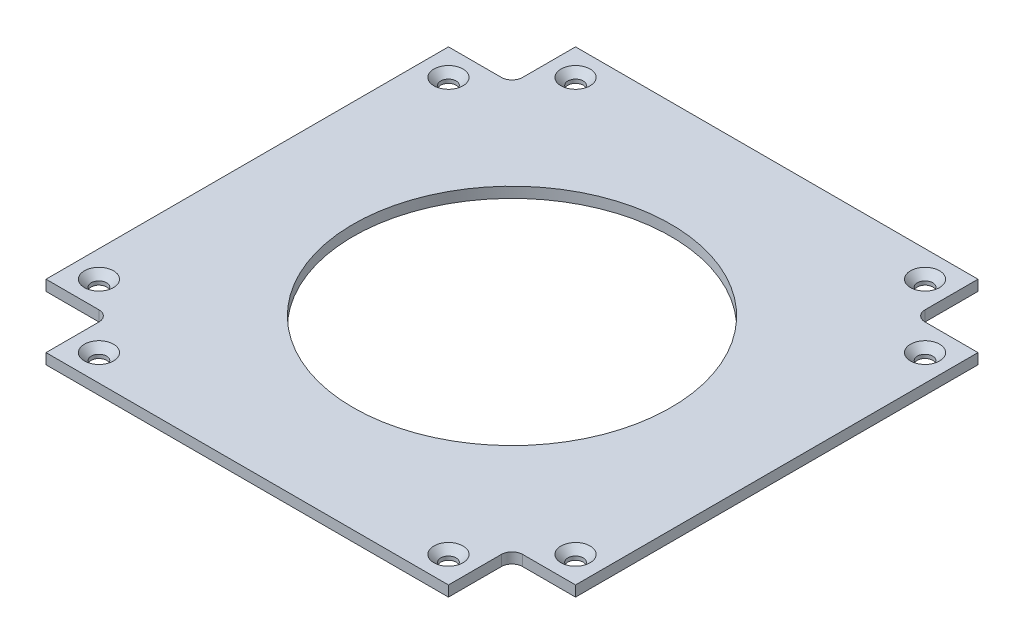
from build123d import *

# Parameters (mm, degrees)
SCHIZZO1_R                              = 30
ESTRUSIONE_ESTRUSIONE1_DEPTH            = 1
RACCORDO1_R                             = 2
FORO_SVASATO_PER_VITE_M2_5_1_AT_2_COUNT = 2
FORO_SVASATO_PER_VITE_M2_5_1_AT_2_PITCH = 16.970562748
FORO_SVASATO_PER_VITE_M2_5_1_AT_3_COUNT = 2
FORO_SVASATO_PER_VITE_M2_5_1_AT_3_PITCH = 78.917678628
FORO_SVASATO_PER_VITE_M2_5_1_AT_4_COUNT = 2
FORO_SVASATO_PER_VITE_M2_5_1_AT_4_PITCH = 90
FORO_SVASATO_PER_VITE_M2_5_1_AT_5_COUNT = 2
FORO_SVASATO_PER_VITE_M2_5_1_AT_5_PITCH = 111.606451426
FORO_SVASATO_PER_VITE_M2_5_1_AT_6_COUNT = 2
FORO_SVASATO_PER_VITE_M2_5_1_AT_6_PITCH = 110.308657865
FORO_SVASATO_PER_VITE_M2_5_1_AT_7_COUNT = 2
FORO_SVASATO_PER_VITE_M2_5_1_AT_7_PITCH = 78.917678628
FORO_SVASATO_PER_VITE_M2_5_1_AT_8_COUNT = 2
FORO_SVASATO_PER_VITE_M2_5_1_AT_8_PITCH = 66


with BuildPart() as part:
    # Schizzo1 → Estrusione-Estrusione1 (new, symmetric)
    with BuildSketch(Plane(origin=(0, 0, 0), x_dir=(1, 0, 0), z_dir=(0, 1, 0))):
        Polygon((-50, -38), (-50, 38), (-38, 38), (-38, 50), (38, 50), (38, 38), (50, 38), (50, -38), (38, -38), (38, -50), (-38, -50), (-38, -38), align=None)
        with Locations(Location((0, 0, 0), (0, 0, 270))):
            Circle(SCHIZZO1_R, mode=Mode.SUBTRACT)
    extrude(amount=ESTRUSIONE_ESTRUSIONE1_DEPTH, both=True)

    # Raccordo1
    raccordo1_edges = [part.edges().sort_by_distance(p)[0] for p in [
        (-38, 0, -38),
        (38, 0, -38),
        (38, 0, 38),
        (-38, 0, 38),
    ]]
    fillet(raccordo1_edges, radius=RACCORDO1_R)

    # Schizzo4 → Foro svasato per Vite M2.5-1 (revolve, cut)
    with BuildSketch(Plane(origin=(-33, 1, -45), x_dir=(0, 0, 1), z_dir=(1, 0, 0))):
        Polygon((0, 0), (0, 2), (1.45, 2), (1.45, 1.3), (2.75, 0), align=None)
    foro_svasato_per_vite_m2_5_1 = revolve(axis=Axis((-33, 7.35, -45), (0, -1, 0)), mode=Mode.SUBTRACT)

    # Foro svasato per Vite M2.5-1 at 2: Foro svasato per Vite M2.5-1 ×2
    with Locations(*[Vector(-0.7071067811865476, 0, 0.7071067811865476) * (i * FORO_SVASATO_PER_VITE_M2_5_1_AT_2_PITCH) for i in range(1, FORO_SVASATO_PER_VITE_M2_5_1_AT_2_COUNT)]):
        add(foro_svasato_per_vite_m2_5_1, mode=Mode.SUBTRACT)

    # Foro svasato per Vite M2.5-1 at 3: Foro svasato per Vite M2.5-1 ×2
    with Locations(*[Vector(-0.15205718425394116, 0, 0.9883716976506172) * (i * FORO_SVASATO_PER_VITE_M2_5_1_AT_3_PITCH) for i in range(1, FORO_SVASATO_PER_VITE_M2_5_1_AT_3_COUNT)]):
        add(foro_svasato_per_vite_m2_5_1, mode=Mode.SUBTRACT)

    # Foro svasato per Vite M2.5-1 at 4: Foro svasato per Vite M2.5-1 ×2
    with Locations(*[(0, 0, i * FORO_SVASATO_PER_VITE_M2_5_1_AT_4_PITCH) for i in range(1, FORO_SVASATO_PER_VITE_M2_5_1_AT_4_COUNT)]):
        add(foro_svasato_per_vite_m2_5_1, mode=Mode.SUBTRACT)

    # Foro svasato per Vite M2.5-1 at 5: Foro svasato per Vite M2.5-1 ×2
    with Locations(*[Vector(0.5913636636275174, 0, 0.8064049958557056) * (i * FORO_SVASATO_PER_VITE_M2_5_1_AT_5_PITCH) for i in range(1, FORO_SVASATO_PER_VITE_M2_5_1_AT_5_COUNT)]):
        add(foro_svasato_per_vite_m2_5_1, mode=Mode.SUBTRACT)

    # Foro svasato per Vite M2.5-1 at 6: Foro svasato per Vite M2.5-1 ×2
    with Locations(*[Vector(0.7071067811865476, 0, 0.7071067811865476) * (i * FORO_SVASATO_PER_VITE_M2_5_1_AT_6_PITCH) for i in range(1, FORO_SVASATO_PER_VITE_M2_5_1_AT_6_COUNT)]):
        add(foro_svasato_per_vite_m2_5_1, mode=Mode.SUBTRACT)

    # Foro svasato per Vite M2.5-1 at 7: Foro svasato per Vite M2.5-1 ×2
    with Locations(*[Vector(0.9883716976506172, 0, 0.1520571842539412) * (i * FORO_SVASATO_PER_VITE_M2_5_1_AT_7_PITCH) for i in range(1, FORO_SVASATO_PER_VITE_M2_5_1_AT_7_COUNT)]):
        add(foro_svasato_per_vite_m2_5_1, mode=Mode.SUBTRACT)

    # Foro svasato per Vite M2.5-1 at 8: Foro svasato per Vite M2.5-1 ×2
    with Locations(*[(i * FORO_SVASATO_PER_VITE_M2_5_1_AT_8_PITCH, 0, 0) for i in range(1, FORO_SVASATO_PER_VITE_M2_5_1_AT_8_COUNT)]):
        add(foro_svasato_per_vite_m2_5_1, mode=Mode.SUBTRACT)


solid = part.part
